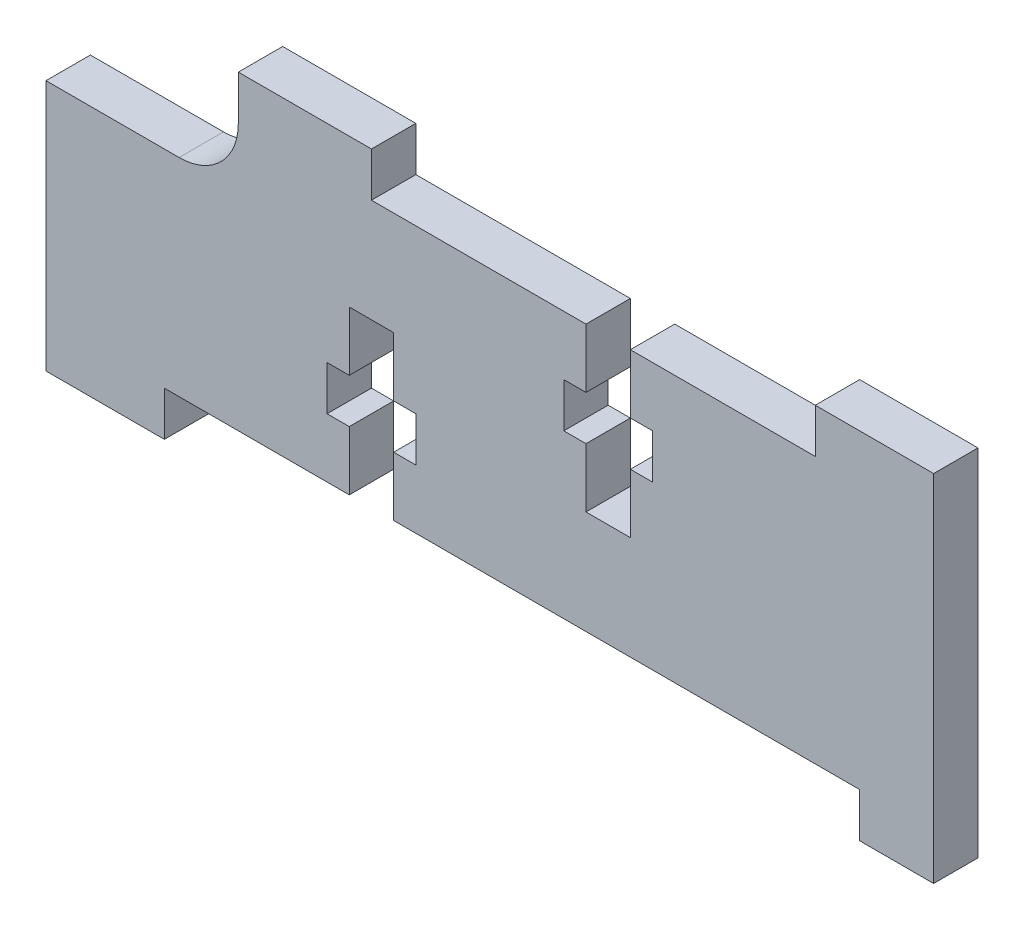
from build123d import *

# Parameters (mm, degrees)
BOSS_EXTRU_5_DEPTH = 3


with BuildPart() as part:
    # Esquisse5 → Boss.-Extru.5 (new body)
    with BuildSketch(Plane.XY):
        with BuildLine():
            Line((-17.14036809, 14.446568203), (-17.14036809, 17.446568203))
            Line((-17.14036809, 17.446568203), (-9.14036809, 17.446568203))
            Line((-9.14036809, 17.446568203), (-9.14036809, -6.553431797))
            Line((-9.14036809, -6.553431797), (-14.14036809, -6.553431797))
            Line((-14.14036809, -6.553431797), (-14.14036809, -3.553431797))
            Line((-14.14036809, -3.553431797), (-45.64036809, -3.553431797))
            Line((-45.64036809, -3.553431797), (-45.64036809, 0.446568203))
            Line((-45.64036809, 0.446568203), (-44.14036809, 0.446568203))
            Line((-44.14036809, 0.446568203), (-44.14036809, 3.446568203))
            Line((-44.14036809, 3.446568203), (-45.64036809, 3.446568203))
            Line((-45.64036809, 3.446568203), (-45.64036809, 7.446568203))
            Line((-45.64036809, 7.446568203), (-48.64036809, 7.446568203))
            Line((-48.64036809, 7.446568203), (-48.64036809, 3.446568203))
            Line((-48.64036809, 3.446568203), (-50.14036809, 3.446568203))
            Line((-50.14036809, 3.446568203), (-50.14036809, 0.446568203))
            Line((-50.14036809, 0.446568203), (-48.64036809, 0.446568203))
            Line((-48.64036809, 0.446568203), (-48.64036809, -3.553431797))
            Line((-48.64036809, -3.553431797), (-61.14036809, -3.553431797))
            Line((-61.14036809, -3.553431797), (-61.14036809, -6.553431797))
            Line((-61.14036809, -6.553431797), (-69.14036809, -6.553431797))
            Line((-69.14036809, -6.553431797), (-69.14036809, 10.446568203))
            Line((-69.14036809, 10.446568203), (-60.14036809, 10.446568203))
            ThreePointArc((-60.14036809, 10.446568203), (-57.311940966, 11.618141078), (-56.14036809, 14.446568203))
            Line((-56.14036809, 14.446568203), (-56.14036809, 17.446568203))
            Line((-56.14036809, 17.446568203), (-47.14036809, 17.446568203))
            Line((-47.14036809, 17.446568203), (-47.14036809, 14.446568203))
            Line((-47.14036809, 14.446568203), (-32.64036809, 14.446568203))
            Line((-32.64036809, 14.446568203), (-32.64036809, 10.446568203))
            Line((-32.64036809, 10.446568203), (-34.14036809, 10.446568203))
            Line((-34.14036809, 10.446568203), (-34.14036809, 7.446568203))
            Line((-34.14036809, 7.446568203), (-32.64036809, 7.446568203))
            Line((-32.64036809, 7.446568203), (-32.64036809, 3.446568203))
            Line((-32.64036809, 3.446568203), (-29.64036809, 3.446568203))
            Line((-29.64036809, 3.446568203), (-29.64036809, 7.446568203))
            Line((-29.64036809, 7.446568203), (-28.14036809, 7.446568203))
            Line((-28.14036809, 7.446568203), (-28.14036809, 10.446568203))
            Line((-28.14036809, 10.446568203), (-29.64036809, 10.446568203))
            Line((-29.64036809, 10.446568203), (-29.64036809, 14.446568203))
            Line((-29.64036809, 14.446568203), (-17.14036809, 14.446568203))
        make_face()
    extrude(amount=BOSS_EXTRU_5_DEPTH)


solid = part.part
